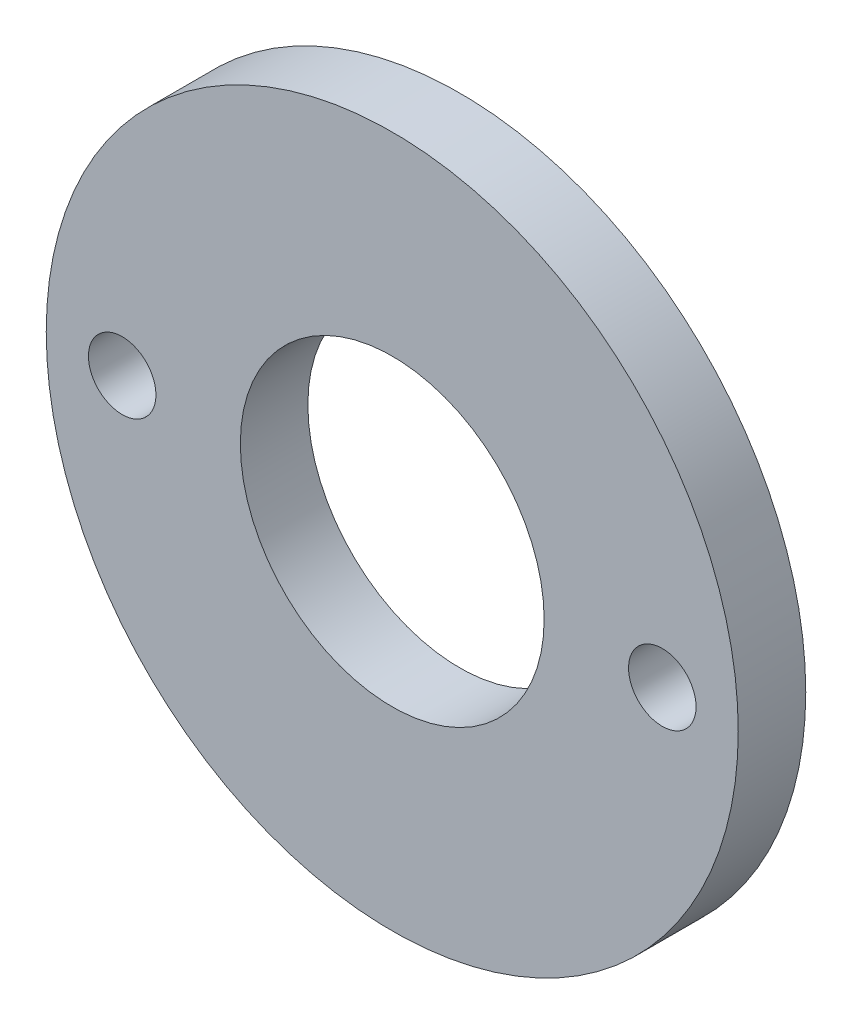
from build123d import *

# Parameters (mm, degrees)
SKETCH_1_R      = 10.25
SKETCH_1_R_2    = 4.5
SKETCH_1_R_3    = 1
EXTRUDE_1_DEPTH = 2


with BuildPart() as part:
    # 草图1 → 凸台-拉伸1 (new body)
    with BuildSketch(Plane.XY):
        Circle(SKETCH_1_R)
        Circle(SKETCH_1_R_2, mode=Mode.SUBTRACT)
        with Locations((-8, 0)):
            Circle(SKETCH_1_R_3, mode=Mode.SUBTRACT)
        with Locations((8, 0)):
            Circle(SKETCH_1_R_3, mode=Mode.SUBTRACT)
    extrude(amount=EXTRUDE_1_DEPTH)


solid = part.part
